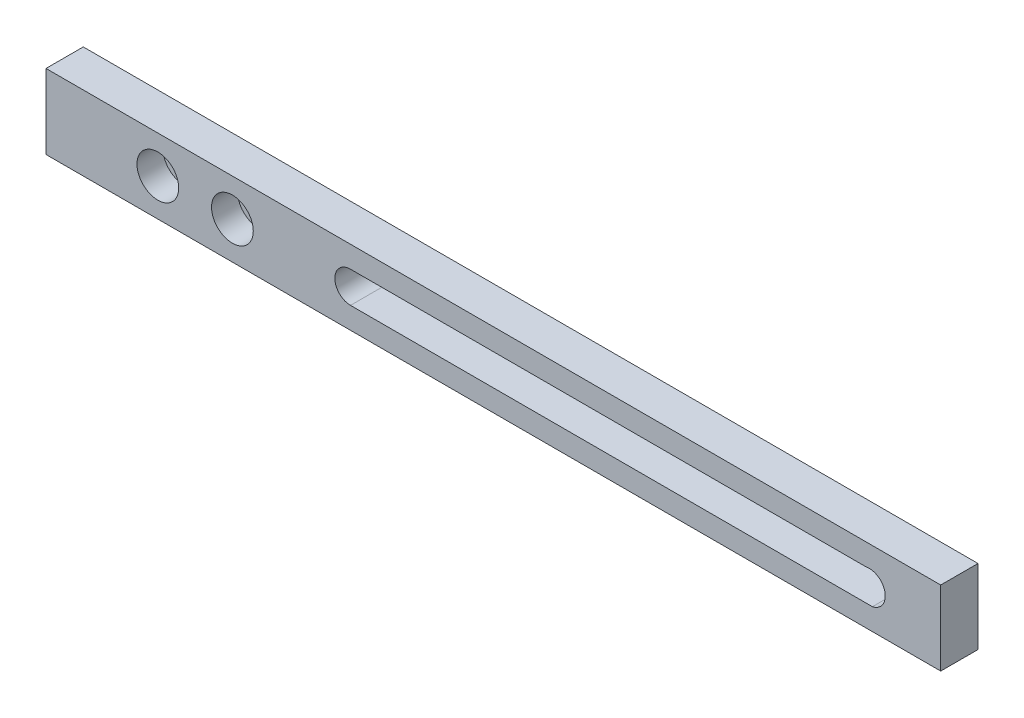
from build123d import *

# Parameters (mm, degrees)
SKETCH_1_W          = 120
SKETCH_1_H          = 10
EXTRUDE_1_DEPTH     = 5
SKETCH_2_R          = 1.25
CUT_EXTRUDE_1_DEPTH = 5
SKETCH_3_R          = 2.8
CUT_EXTRUDE_2_DEPTH = 3.5


with BuildPart() as part:
    # Эскиз1 → Бобышка-Вытянуть1 (new body)
    with BuildSketch(Plane.XY):
        Rectangle(SKETCH_1_W, SKETCH_1_H)
    extrude(amount=EXTRUDE_1_DEPTH)

    # Эскиз2 → Вырез-Вытянуть1 (cut)
    with BuildSketch(Plane.XY.offset(5)):
        with Locations((-45, 0)):
            Circle(SKETCH_2_R)
        with Locations((-35, 0)):
            Circle(SKETCH_2_R)
        with BuildLine():
            Line((-19.160353307, 2.1), (50, 2.1))
            ThreePointArc((50, 2.1), (52.519823346, 0.419823346), (50.839646693, -2.1))
            Line((50.839646693, -2.1), (-19.160353307, -2.1))
            ThreePointArc((-19.160353307, -2.1), (-21.260353307, 0), (-19.160353307, 2.1))
        make_face()
    extrude(amount=-CUT_EXTRUDE_1_DEPTH, mode=Mode.SUBTRACT)

    # Эскиз3 → Вырез-Вытянуть2 (cut)
    with BuildSketch(Plane.XY.offset(5)):
        with Locations((-45, 0)):
            Circle(SKETCH_3_R)
        with Locations((-35, 0)):
            Circle(SKETCH_3_R)
    extrude(amount=-CUT_EXTRUDE_2_DEPTH, mode=Mode.SUBTRACT)


solid = part.part
